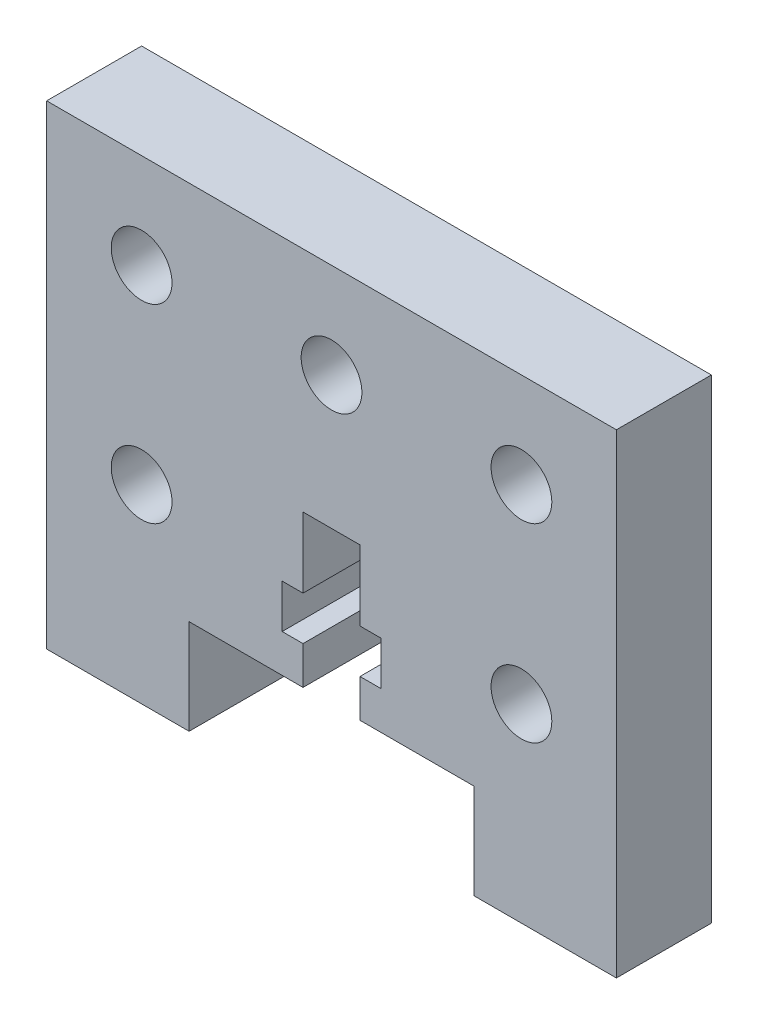
from build123d import *

# Parameters (mm, degrees)
ESQUISSE1_R        = 1.6
BOSS_EXTRU_1_DEPTH = 5


with BuildPart() as part:
    # Esquisse1 → Boss.-Extru.1 (new body)
    with BuildSketch(Plane.XY):
        Polygon((0, 0), (7.5, 0), (7.5, 5), (13.5, 5), (13.5, 7), (12.4, 7), (12.4, 9.3), (13.5, 9.3), (13.5, 13), (16.5, 13), (16.5, 9.3), (17.6, 9.3), (17.6, 7), (16.5, 7), (16.5, 5), (22.5, 5), (22.5, 0), (30, 0), (30, 25), (0, 25), align=None)
        with Locations((5, 10)):
            Circle(ESQUISSE1_R, mode=Mode.SUBTRACT)
        with Locations((5, 20)):
            Circle(ESQUISSE1_R, mode=Mode.SUBTRACT)
        with Locations((25, 10)):
            Circle(ESQUISSE1_R, mode=Mode.SUBTRACT)
        with Locations((15, 20)):
            Circle(ESQUISSE1_R, mode=Mode.SUBTRACT)
        with Locations((25, 20)):
            Circle(ESQUISSE1_R, mode=Mode.SUBTRACT)
    extrude(amount=BOSS_EXTRU_1_DEPTH)


solid = part.part
